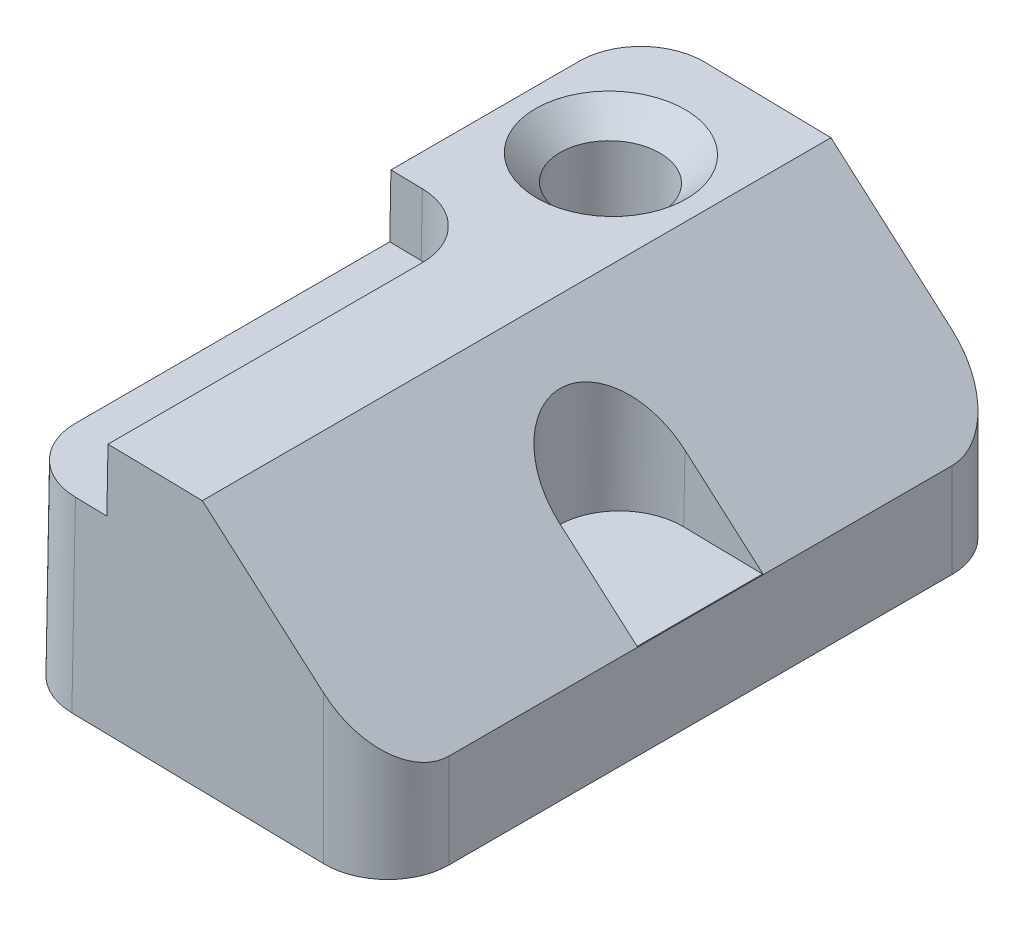
from build123d import *

# Parameters (mm, degrees)
BOSS_EXTRUDE1_DEPTH = 127
SKETCH2_R           = 10.16
CUT_EXTRUDE1_DEPTH  = 157.585578439
CHAMFER1_SIZE       = 5.08
SKETCH3_W           = 19.05
SKETCH3_H           = 76.2
CUT_EXTRUDE2_DEPTH  = 12.7
FILLET1_R           = 12.7
CUT_EXTRUDE4_DEPTH  = 31.762338
FILLET2_R           = 12.7
FILLET3_R           = 12.7
FILLET4_R           = 12.7
FILLET5_R           = 12.7


with BuildPart() as part:
    # Sketch1 → Boss-Extrude1 (new body)
    with BuildSketch(Plane.XY):
        Polygon((0, 0), (0.954886233, 50.8), (39.054886233, 50.083835325), (76.2, 17.617670651), (76.2, -1.432329349), align=None)
    extrude(amount=BOSS_EXTRUDE1_DEPTH)

    # Sketch2 → Cut-Extrude1 (cut, through all)
    with BuildSketch(Plane(origin=(0.954886233, 50.8, 0), x_dir=(0.9998233837023289, -0.01879365323787949, 0), z_dir=(0.01879365323787949, 0.999823383702329, 0))):
        with Locations(Location((19.05, -25.4, 0), (0, 0, 180))):
            Circle(SKETCH2_R)
    extrude(amount=-CUT_EXTRUDE1_DEPTH, mode=Mode.SUBTRACT)

    # Chamfer1
    chamfer1_edges = [part.edges().sort_by_distance(p)[0] for p in [
        (30.159727271, 50.251037389, 25.4),
    ]]
    chamfer(chamfer1_edges, length=CHAMFER1_SIZE)

    # Sketch3 → Cut-Extrude2 (cut)
    with BuildSketch(Plane(origin=(0.954886233, 50.8, 0), x_dir=(0.9998233837023289, -0.01879365323787949, 0), z_dir=(0.01879365323787949, 0.999823383702329, 0))):
        with Locations((9.525, -88.9)):
            Rectangle(SKETCH3_W, SKETCH3_H)
    extrude(amount=-CUT_EXTRUDE2_DEPTH, mode=Mode.SUBTRACT)

    # Fillet1
    fillet1_edges = [part.edges().sort_by_distance(p)[0] for p in [
        (19.882181994, 44.093102419, 50.8),
    ]]
    fillet(fillet1_edges, radius=FILLET1_R)

    # Sketch10 → Cut-Extrude4 (cut)
    with BuildSketch(Plane(origin=(0.954886233, 50.8, 0), x_dir=(0.9998233837023289, -0.01879365323787949, 0), z_dir=(0.01879365323787949, 0.999823383702329, 0))):
        with BuildLine():
            Line((75.755441679, -50.8), (59.753441679, -50.8))
            ThreePointArc((59.753441679, -50.8), (47.053441679, -63.5), (59.753441679, -76.2))
            Line((59.753441679, -76.2), (75.755441679, -76.2))
            Line((75.755441679, -76.2), (75.755441679, -50.8))
        make_face()
    extrude(amount=-CUT_EXTRUDE4_DEPTH, mode=Mode.SUBTRACT)

    # Fillet2
    fillet2_edges = [part.edges().sort_by_distance(p)[0] for p in [
        (76.2, 8.092670651, 127),
    ]]
    fillet(fillet2_edges, radius=FILLET2_R)

    # Fillet3
    fillet3_edges = [part.edges().sort_by_distance(p)[0] for p in [
        (0.358103418, 19.051121513, 127),
    ]]
    fillet(fillet3_edges, radius=FILLET3_R)

    # Fillet4
    fillet4_edges = [part.edges().sort_by_distance(p)[0] for p in [
        (0.477443116, 25.4, 0),
    ]]
    fillet(fillet4_edges, radius=FILLET4_R)

    # Fillet5
    fillet5_edges = [part.edges().sort_by_distance(p)[0] for p in [
        (76.2, 8.092670651, 0),
    ]]
    fillet(fillet5_edges, radius=FILLET5_R)


solid = part.part
